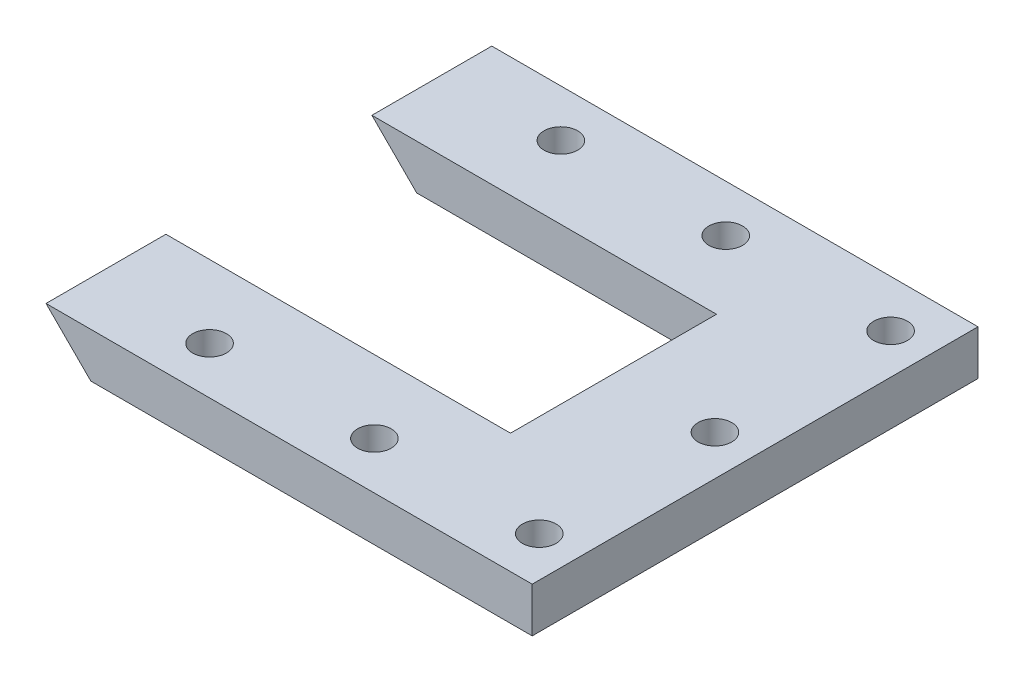
from build123d import *

# Parameters (mm, degrees)
SKETCH1_W           = 102.997
SKETCH1_H           = 94.4372
BOSS_EXTRUDE1_DEPTH = 4.7498
CUT_EXTRUDE2_START  = 4.7498
SKETCH2_W           = 175.9966
SKETCH2_H           = 43.6372
CUT_EXTRUDE2_DEPTH  = 75.780166901
CUT_EXTRUDE6_START  = 47.2186
CUT_EXTRUDE6_DEPTH  = 118.248966901
CUT_EXTRUDE8_START  = -4.7498
SKETCH4_R           = 3.5687
CUT_EXTRUDE8_DEPTH  = 75.780166901
CUT_EXTRUDE10_START = -4.7498
SKETCH5_R           = 3.5687
CUT_EXTRUDE10_DEPTH = 75.780166901


with BuildPart() as part:
    # Sketch1 → Boss-Extrude1 (new, symmetric)
    with BuildSketch(Plane(origin=(0, 0, 0), x_dir=(1, 0, 0), z_dir=(0, 1, 0))):
        Rectangle(SKETCH1_W, SKETCH1_H)
    extrude(amount=BOSS_EXTRUDE1_DEPTH, both=True)

    # Sketch2 → Cut-Extrude2 (cut, through all)
    with BuildSketch(Plane(origin=(0, 0, 0), x_dir=(1, 0, 0), z_dir=(0, 1, 0)).offset(CUT_EXTRUDE2_START)):
        with Locations((-66.4972, 0)):
            Rectangle(SKETCH2_W, SKETCH2_H)
    extrude(amount=-CUT_EXTRUDE2_DEPTH, mode=Mode.SUBTRACT)

    # Sketch3 → Cut-Extrude6 (cut, through all)
    with BuildSketch(Plane.XY.offset(CUT_EXTRUDE6_START)):
        Polygon((-154.4955, -14.2494), (-32.4993, -14.2494), (-60.9981, 14.2494), (-154.4955, 14.2494), align=None)
    extrude(amount=-CUT_EXTRUDE6_DEPTH, mode=Mode.SUBTRACT)

    # Sketch4 → Cut-Extrude8 (cut, through all)
    with BuildSketch(Plane(origin=(0, 0, 0), x_dir=(1, 0, 0), z_dir=(0, 1, 0)).offset(CUT_EXTRUDE8_START)):
        with Locations(Location((-26.8605, -37.211, 0), (0, 0, 270))):
            Circle(SKETCH4_R)
        with Locations(Location((8.0645, -37.211, 0), (0, 0, 270))):
            Circle(SKETCH4_R)
        with Locations(Location((42.9895, -37.211, 0), (0, 0, 270))):
            Circle(SKETCH4_R)
        with Locations(Location((-26.8605, 37.211, 0), (0, 0, 270))):
            Circle(SKETCH4_R)
        with Locations(Location((8.0645, 37.211, 0), (0, 0, 270))):
            Circle(SKETCH4_R)
        with Locations(Location((42.9895, 37.211, 0), (0, 0, 270))):
            Circle(SKETCH4_R)
    extrude(amount=CUT_EXTRUDE8_DEPTH, mode=Mode.SUBTRACT)

    # Sketch5 → Cut-Extrude10 (cut, through all)
    with BuildSketch(Plane(origin=(0, 0, 0), x_dir=(1, 0, 0), z_dir=(0, 1, 0)).offset(CUT_EXTRUDE10_START)):
        with Locations(Location((42.9895, 0, 0), (0, 0, 270))):
            Circle(SKETCH5_R)
    extrude(amount=CUT_EXTRUDE10_DEPTH, mode=Mode.SUBTRACT)


solid = part.part
